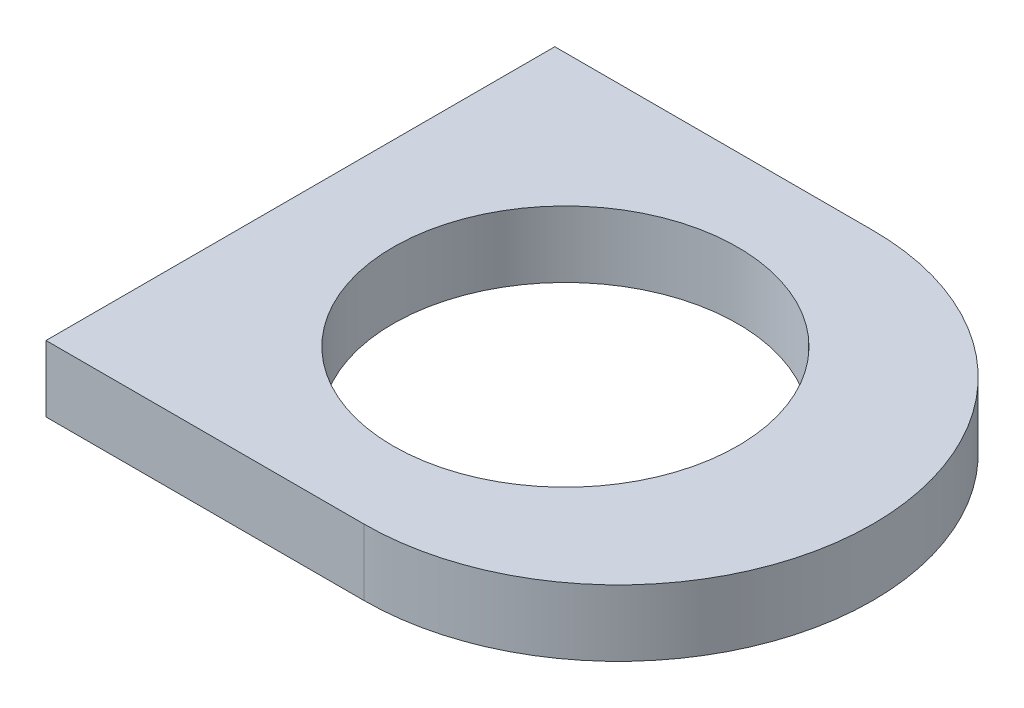
from build123d import *

# Parameters (mm, degrees)
SKETCH1_R           = 32.5
BOSS_EXTRUDE1_DEPTH = 12.5


with BuildPart() as part:
    # Sketch1 → Boss-Extrude1 (new body)
    # profile 1 of 2: a face of its own
    with BuildSketch(Plane(origin=(0, 0, 0), x_dir=(1, 0, 0), z_dir=(0, 1, 0))):
        with BuildLine():
            Line((0, -48), (10, -48))
            ThreePointArc((10, -48), (58, 0), (10, 48))
            Line((10, 48), (0, 48))
            Line((0, 48), (-50, 48))
            Line((-50, 48), (-50, -48))
            Line((-50, -48), (0, -48))
        make_face()
        with BuildLine():
            ThreePointArc((10, -40), (50, 0), (10, 40))
            Line((10, 40), (0, 40))
            Line((0, 40), (-42, 40))
            Line((-42, 40), (-42, -40))
            Line((-42, -40), (0, -40))
            Line((0, -40), (10, -40))
        make_face(mode=Mode.SUBTRACT)
    # profile 2 of 2: a face of its own
    with BuildSketch(Plane(origin=(0, 0, 0), x_dir=(1, 0, 0), z_dir=(0, 1, 0))):
        with BuildLine():
            Line((0, -40), (10, -40))
            ThreePointArc((10, -40), (50, 0), (10, 40))
            Line((10, 40), (0, 40))
            Line((0, 40), (-42, 40))
            Line((-42, 40), (-42, -40))
            Line((-42, -40), (0, -40))
        make_face()
        with Locations(Location((0, 0, 0), (0, 0, 270))):
            Circle(SKETCH1_R, mode=Mode.SUBTRACT)
    extrude(amount=BOSS_EXTRUDE1_DEPTH)


solid = part.part
